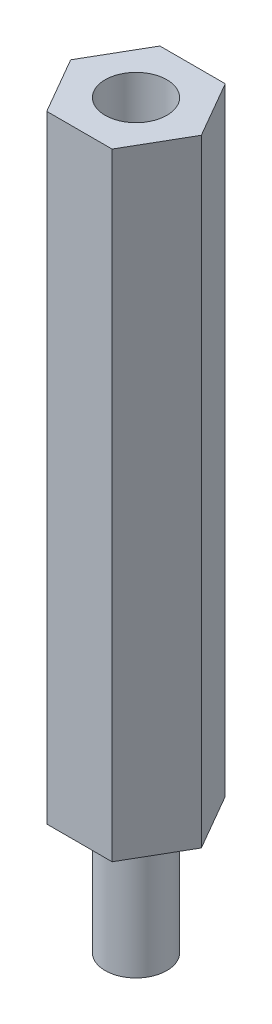
from build123d import *

# Parameters (mm, degrees)
BOSS_EXTRUDE1_DEPTH = 30
SKETCH2_R           = 1.5
CUT_EXTRUDE1_DEPTH  = 15
SKETCH3_R           = 1.5
BOSS_EXTRUDE2_DEPTH = 6


with BuildPart() as part:
    # Sketch1 → Boss-Extrude1 (new body)
    with BuildSketch(Plane(origin=(0, 0, 0), x_dir=(1, 0, 0), z_dir=(0, 1, 0))):
        Polygon((-1.58771324, -2.75), (1.58771324, -2.75), (3.175426481, 0), (1.58771324, 2.75), (-1.58771324, 2.75), (-3.175426481, 0), align=None)
    extrude(amount=BOSS_EXTRUDE1_DEPTH)

    # Sketch2 → Cut-Extrude1 (cut)
    with BuildSketch(Plane(origin=(0, 30, 0), x_dir=(1, 0, 0), z_dir=(0, 1, 0))):
        with Locations(Location((0, 0, 0), (0, 0, 270))):
            Circle(SKETCH2_R)
    extrude(amount=-CUT_EXTRUDE1_DEPTH, mode=Mode.SUBTRACT)

    # Sketch3 → Boss-Extrude2 (add)
    with BuildSketch(Plane.XZ):
        with Locations(Location((0, 0, 0), (0, 0, 90))):
            Circle(SKETCH3_R)
    extrude(amount=BOSS_EXTRUDE2_DEPTH)


solid = part.part
